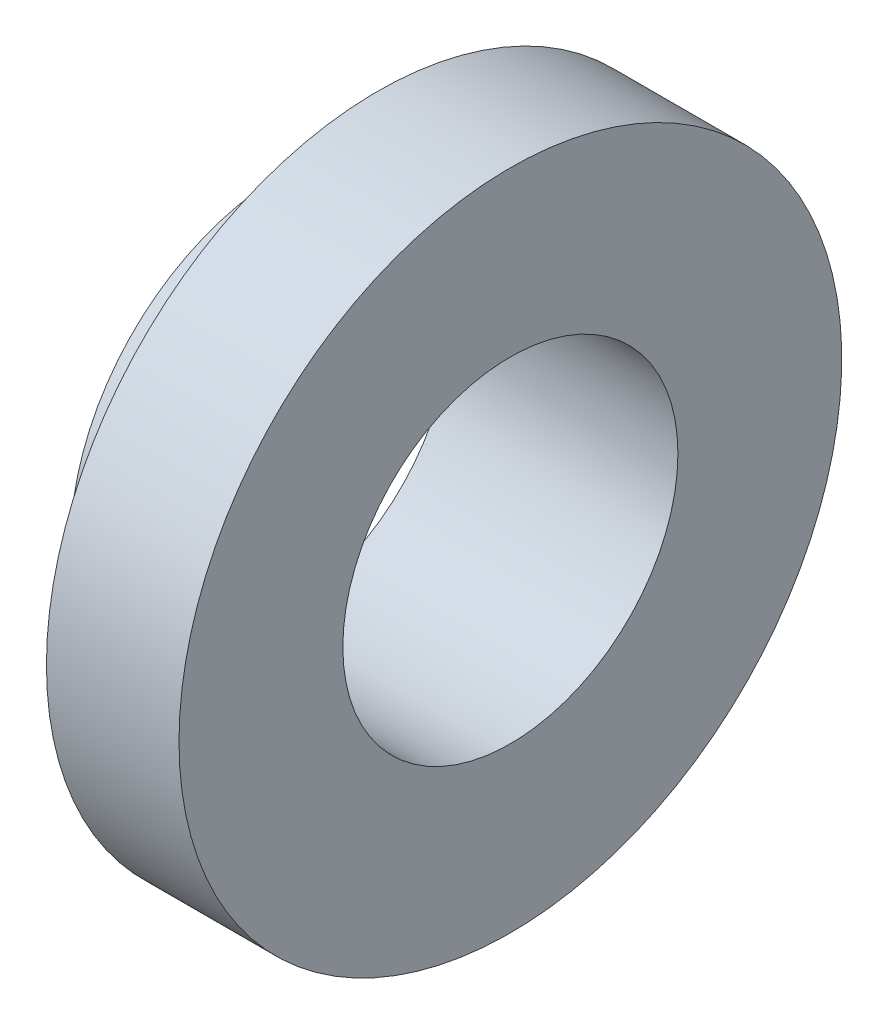
from build123d import *


with BuildPart() as part:
    # Sketch2 → Revolve1 (revolve)
    with BuildSketch(Plane.XY, mode=Mode.PRIVATE) as revolve1_sk:
        Polygon((2.2752, 7.9375), (2.2752, 5.08), (0, 5.08), (0, 4.0132), (5.4502, 4.0132), (5.4502, 7.9375), align=None)
    revolve(revolve1_sk.sketch.rotate(Axis((0, 0, 0), (1, 0, 0)), 90), axis=Axis((0, 0, 0), (1, 0, 0)))


solid = part.part
